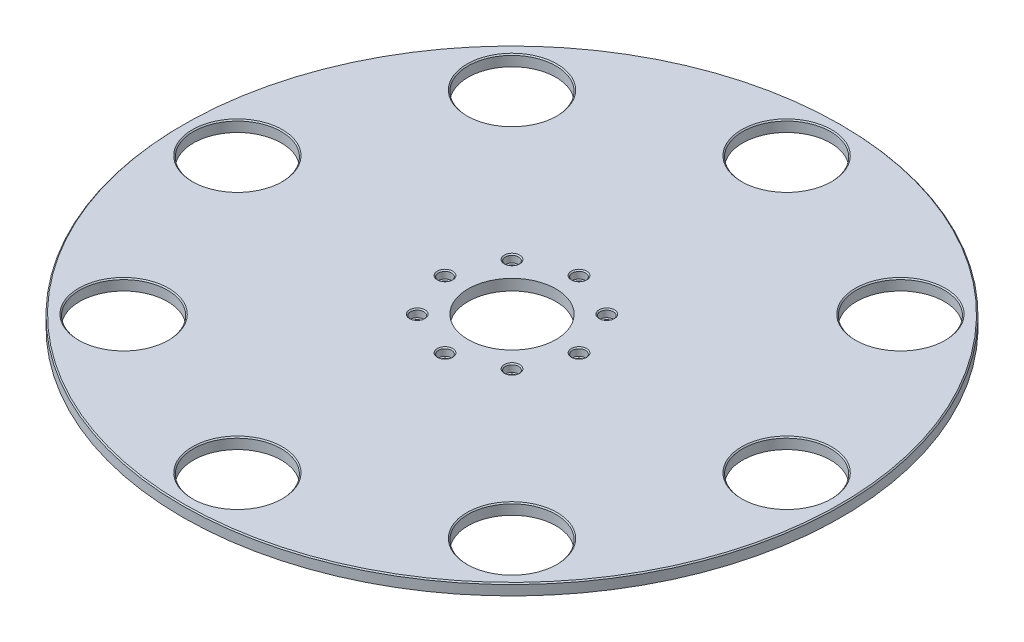
from build123d import *

# Parameters (mm, degrees)
SKETCH2_R            = 300
SKETCH2_R_2          = 40
BOSS_EXTRUDE10_DEPTH = 10
CHAMFER1_SIZE        = 1
SKETCH13_R           = 6
CUT_EXTRUDE1_DEPTH   = 7
CHAMFER2_SIZE        = 1
SKETCH14_R           = 4
CUT_EXTRUDE2_DEPTH   = 3


with BuildPart() as part:
    # Sketch2 → Boss-Extrude10 (new body)
    with BuildSketch(Plane(origin=(0, 0, 0), x_dir=(1, 0, 0), z_dir=(0, 1, 0))):
        with Locations(Location((0, 0, 0), (0, 0, 270))):
            Circle(SKETCH2_R)
        with Locations(Location((0, 0, 0), (0, 0, 270))):
            Circle(SKETCH2_R_2, mode=Mode.SUBTRACT)
        with Locations(Location((0, 250, 0), (0, 0, 270))):
            Circle(SKETCH2_R_2, mode=Mode.SUBTRACT)
        with Locations(Location((176.776695297, 176.776695297, 0), (0, 0, 270))):
            Circle(SKETCH2_R_2, mode=Mode.SUBTRACT)
        with Locations(Location((250, 0, 0), (0, 0, 270))):
            Circle(SKETCH2_R_2, mode=Mode.SUBTRACT)
        with Locations(Location((176.776695297, -176.776695297, 0), (0, 0, 270))):
            Circle(SKETCH2_R_2, mode=Mode.SUBTRACT)
        with Locations(Location((0, -250, 0), (0, 0, 270))):
            Circle(SKETCH2_R_2, mode=Mode.SUBTRACT)
        with Locations(Location((-176.776695297, -176.776695297, 0), (0, 0, 270))):
            Circle(SKETCH2_R_2, mode=Mode.SUBTRACT)
        with Locations(Location((-250, 0, 0), (0, 0, 270))):
            Circle(SKETCH2_R_2, mode=Mode.SUBTRACT)
        with Locations(Location((-176.776695297, 176.776695297, 0), (0, 0, 270))):
            Circle(SKETCH2_R_2, mode=Mode.SUBTRACT)
    extrude(amount=BOSS_EXTRUDE10_DEPTH)

    # Chamfer1
    chamfer1_edges = [part.edges().sort_by_distance(p)[0] for p in [
        (176.776695297, 10, -216.776695297),
        (250, 10, -40),
        (176.776695297, 10, 136.776695297),
        (0, 10, 210),
        (-176.776695297, 10, 136.776695297),
        (-250, 10, -40),
        (-176.776695297, 10, -216.776695297),
        (0, 10, -300),
        (0, 10, -290),
    ]]
    chamfer(chamfer1_edges, length=CHAMFER1_SIZE)

    # Sketch13 → Cut-Extrude1 (cut)
    with BuildSketch(Plane(origin=(0, 10, 0), x_dir=(1, 0, 0), z_dir=(0, 1, 0))):
        with Locations(Location((-61, 0, 0), (0, 0, 270))):
            Circle(SKETCH13_R)
        with Locations(Location((-43.133513652, 43.133513652, 0), (0, 0, 270))):
            Circle(SKETCH13_R)
        with Locations(Location((0, 61, 0), (0, 0, 270))):
            Circle(SKETCH13_R)
        with Locations(Location((43.133513652, 43.133513652, 0), (0, 0, 270))):
            Circle(SKETCH13_R)
        with Locations(Location((61, 0, 0), (0, 0, 270))):
            Circle(SKETCH13_R)
        with Locations(Location((43.133513652, -43.133513652, 0), (0, 0, 270))):
            Circle(SKETCH13_R)
        with Locations(Location((0, -61, 0), (0, 0, 270))):
            Circle(SKETCH13_R)
        with Locations(Location((-43.133513652, -43.133513652, 0), (0, 0, 270))):
            Circle(SKETCH13_R)
    extrude(amount=-CUT_EXTRUDE1_DEPTH, mode=Mode.SUBTRACT)

    # Chamfer2
    chamfer2_edges = [part.edges().sort_by_distance(p)[0] for p in [
        (-61, 10, -6),
        (-43.133513652, 10, -49.133513652),
        (0, 10, -67),
        (43.133513652, 10, -49.133513652),
        (61, 10, -6),
        (43.133513652, 10, 37.133513652),
        (0, 10, 55),
        (-43.133513652, 10, 37.133513652),
    ]]
    chamfer(chamfer2_edges, length=CHAMFER2_SIZE)

    # Sketch14 → Cut-Extrude2 (cut)
    with BuildSketch(Plane.XZ):
        with Locations(Location((-61, 0, 0), (0, 0, 270))):
            Circle(SKETCH14_R)
        with Locations(Location((-43.133513652, 43.133513652, 0), (0, 0, 270))):
            Circle(SKETCH14_R)
        with Locations(Location((0, 61, 0), (0, 0, 270))):
            Circle(SKETCH14_R)
        with Locations(Location((43.133513652, 43.133513652, 0), (0, 0, 270))):
            Circle(SKETCH14_R)
        with Locations(Location((61, 0, 0), (0, 0, 270))):
            Circle(SKETCH14_R)
        with Locations(Location((43.133513652, -43.133513652, 0), (0, 0, 270))):
            Circle(SKETCH14_R)
        with Locations(Location((0, -61, 0), (0, 0, 270))):
            Circle(SKETCH14_R)
        with Locations(Location((-43.133513652, -43.133513652, 0), (0, 0, 270))):
            Circle(SKETCH14_R)
    extrude(amount=-CUT_EXTRUDE2_DEPTH, mode=Mode.SUBTRACT)


solid = part.part
